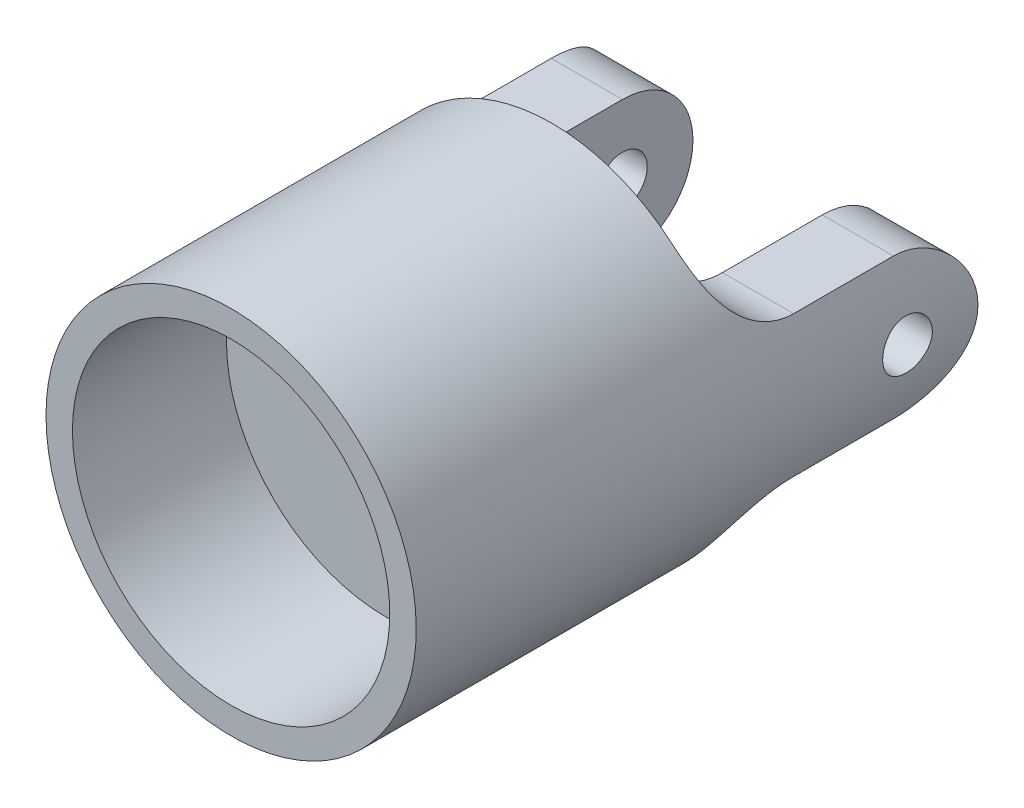
from build123d import *

# Parameters (mm, degrees)
CUT_EXTRUDE1_DEPTH      = 39.29792341
CUT_EXTRUDE1_DEPTH_BACK = 39.29792341
CUT_EXTRUDE2_DEPTH      = 39.297923559
CUT_EXTRUDE2_DEPTH_BACK = 39.297923559
CUT_EXTRUDE3_DEPTH      = 20
CUT_EXTRUDE3_DEPTH_BACK = 10
SKETCH5_R               = 1.49
SKETCH6_R               = 9.525
BOSS_EXTRUDE1_DEPTH     = 4.32
SKETCH7_W               = 30.231147159
SKETCH7_H               = 26.898579755
CUT_EXTRUDE4_DEPTH      = 5.43


with BuildPart() as part:
    # Sketch1 → Revolve1 (revolve)
    with BuildSketch(Plane(origin=(0, 0, 0), x_dir=(0, 0, -1), z_dir=(1, 0, 0))):
        Polygon((-34.925, 11.1125), (-34.925, 9.525), (-15.925, 9.525), (-15.925, 0), (11.1125, 0), (11.1125, 11.1125), align=None)
    revolve(axis=Axis((0, 0, 0), (0, 0, 1)))

    # Sketch3 → Cut-Extrude1 (cut, two sides: drawn at the far end of the back side and taken through both)
    with BuildSketch(Plane(origin=(0, 0, 0), x_dir=(0, 0, -1), z_dir=(1, 0, 0)).offset(-CUT_EXTRUDE1_DEPTH_BACK)):
        with BuildLine():
            Line((11.1125, 11.1125), (-10.233333333, 11.1125))
            Line((-10.233333333, 11.1125), (-10.233333333, 8.466666667))
            ThreePointArc((-10.233333333, 8.466666667), (-8.993418707, 5.47324796), (-6, 4.233333333))
            Line((-6, 4.233333333), (0, 4.233333333))
            ThreePointArc((0, 4.233333333), (4.233333333, 0), (0, -4.233333333))
            Line((0, -4.233333333), (-6, -4.233333333))
            ThreePointArc((-6, -4.233333333), (-8.993418707, -5.47324796), (-10.233333333, -8.466666667))
            Line((-10.233333333, -8.466666667), (-10.233333333, -11.1125))
            Line((-10.233333333, -11.1125), (11.1125, -11.1125))
            Line((11.1125, -11.1125), (11.1125, 11.1125))
        make_face()
    extrude(amount=CUT_EXTRUDE1_DEPTH + CUT_EXTRUDE1_DEPTH_BACK, mode=Mode.SUBTRACT)

    # Sketch4 → Cut-Extrude2 (cut, two sides: drawn at the far end of the back side and taken through both)
    with BuildSketch(Plane(origin=(0, 0, 0), x_dir=(1, 0, 0), z_dir=(0, 1, 0)).offset(-CUT_EXTRUDE2_DEPTH_BACK)):
        with BuildLine():
            Line((-2.825, -10.233333333), (2.825, -10.233333333))
            ThreePointArc((2.825, -10.233333333), (5.07006403, -9.303397364), (6, -7.058333333))
            Line((6, -7.058333333), (6, 4.233333333))
            Line((6, 4.233333333), (-6, 4.233333333))
            Line((-6, 4.233333333), (-6, -7.058333333))
            ThreePointArc((-6, -7.058333333), (-5.07006403, -9.303397364), (-2.825, -10.233333333))
        make_face()
    extrude(amount=CUT_EXTRUDE2_DEPTH + CUT_EXTRUDE2_DEPTH_BACK, mode=Mode.SUBTRACT)

    # Sketch5 → Cut-Extrude3 (cut, two sides: drawn at the far end of the back side and taken through both)
    with BuildSketch(Plane(origin=(-6, 0, 0), x_dir=(0, 0, -1), z_dir=(1, 0, 0)).offset(-CUT_EXTRUDE3_DEPTH_BACK)):
        Circle(SKETCH5_R)
    extrude(amount=CUT_EXTRUDE3_DEPTH + CUT_EXTRUDE3_DEPTH_BACK, mode=Mode.SUBTRACT)

    # Sketch6 → Boss-Extrude1 (add)
    with BuildSketch(Plane.XY.offset(15.925)):
        Circle(SKETCH6_R)
    extrude(amount=BOSS_EXTRUDE1_DEPTH)

    # Sketch7 → Cut-Extrude4 (cut)
    with BuildSketch(Plane.XY.offset(34.925)):
        with Locations((1.508431665, -0.773631718)):
            Rectangle(SKETCH7_W, SKETCH7_H)
    extrude(amount=-CUT_EXTRUDE4_DEPTH, mode=Mode.SUBTRACT)


solid = part.part
